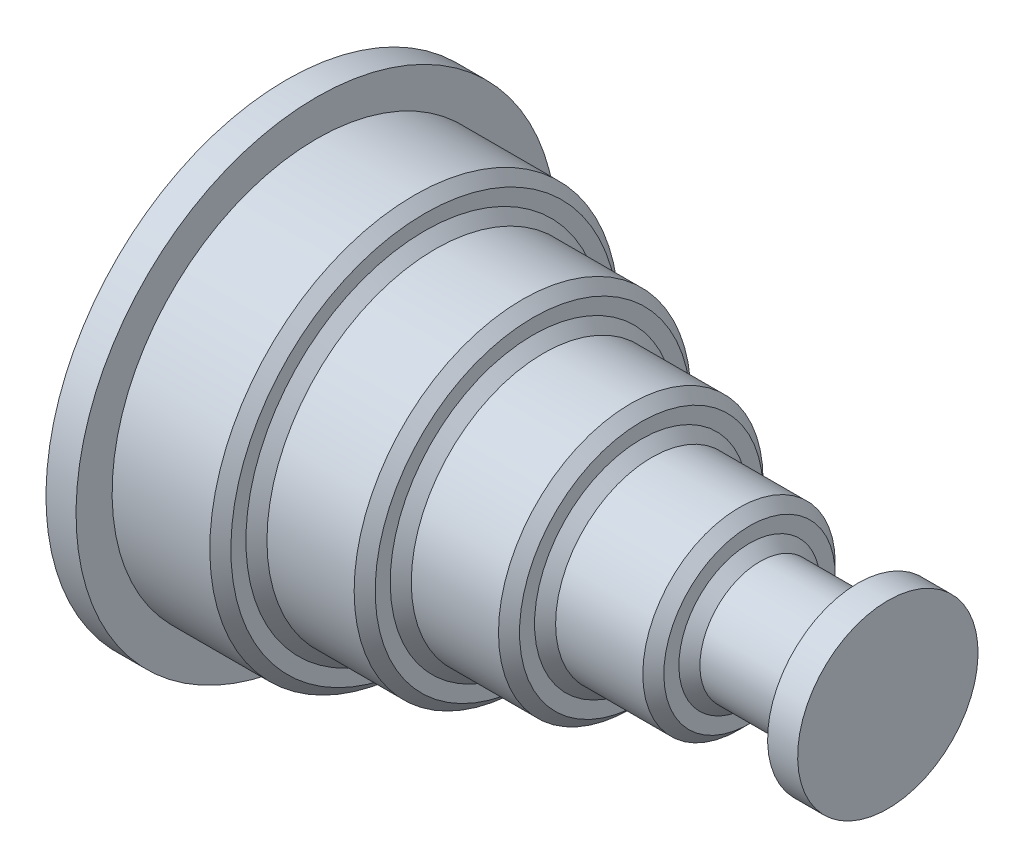
from build123d import *

# Parameters (mm, degrees)
CHAMFER1_SIZE = 0.35


with BuildPart() as part:
    # Sketch1 → Revolve1 (revolve)
    with BuildSketch(Plane.XY):
        Polygon((0, 0), (0, 8), (1, 8), (1, 6.8), (4.6, 6.8), (4.6, 5.6), (8.2, 5.6), (8.2, 4.4), (11.8, 4.4), (11.8, 3.2), (15.4, 3.2), (15.4, 2), (19, 2), (19, 3), (20, 3), (20, 0), align=None)
    revolve(axis=Axis((20, 0, 0), (-1, 0, 0)))

    # Chamfer1
    chamfer1_edges = [part.edges().sort_by_distance(p)[0] for p in [
        (15.4, -2, 0),
        (15.4, -3.2, 0),
        (11.8, -3.2, 0),
        (11.8, -4.4, 0),
        (8.2, -4.4, 0),
        (8.2, -5.6, 0),
        (4.6, -5.6, 0),
        (4.6, -6.8, 0),
    ]]
    chamfer(chamfer1_edges, length=CHAMFER1_SIZE)


solid = part.part
